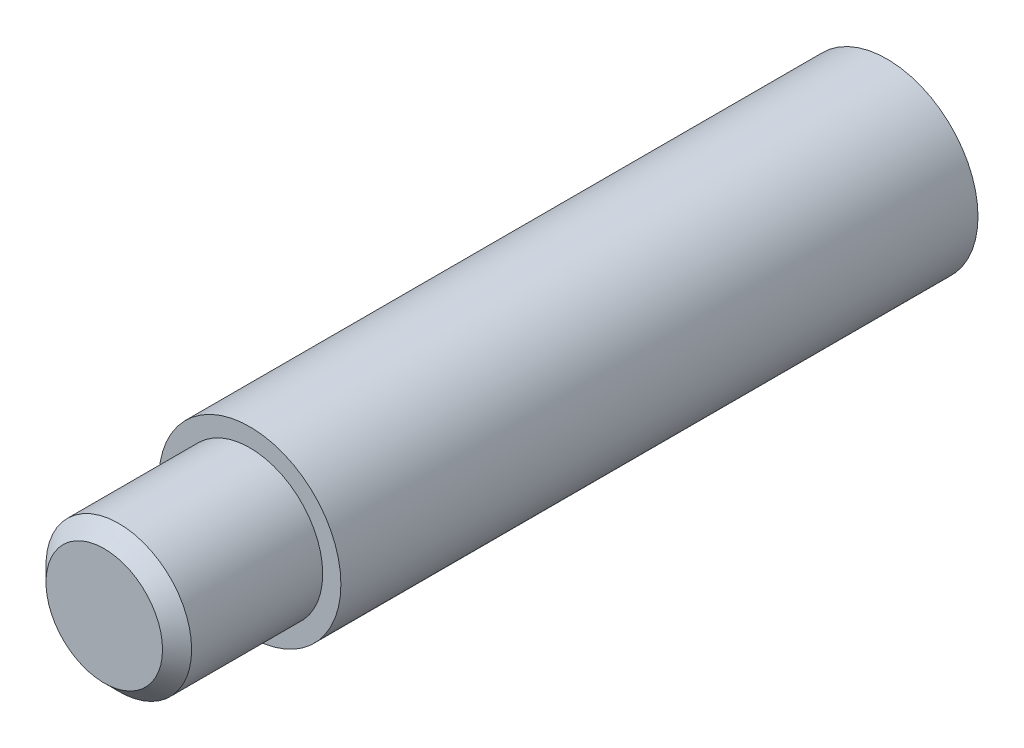
from build123d import *

# Parameters (mm, degrees)
ESQUISSE1_R          = 5
BASE_EXTRUSION_DEPTH = 35
ESQUISSE4_R          = 4
BOSS_EXTRU_1_DEPTH   = 8
CHANFREIN1_SIZE      = 0.8


with BuildPart() as part:
    # Esquisse1 → Base-Extrusion (new body)
    with BuildSketch(Plane.XY):
        Circle(ESQUISSE1_R)
    extrude(amount=BASE_EXTRUSION_DEPTH)

    # Esquisse4 → Boss.-Extru.1 (add)
    with BuildSketch(Plane.XY.offset(35)):
        Circle(ESQUISSE4_R)
    extrude(amount=BOSS_EXTRU_1_DEPTH)

    # Chanfrein1
    chanfrein1_edges = [part.edges().sort_by_distance(p)[0] for p in [
        (-4, 0, 43),
    ]]
    chamfer(chanfrein1_edges, length=CHANFREIN1_SIZE)


solid = part.part
